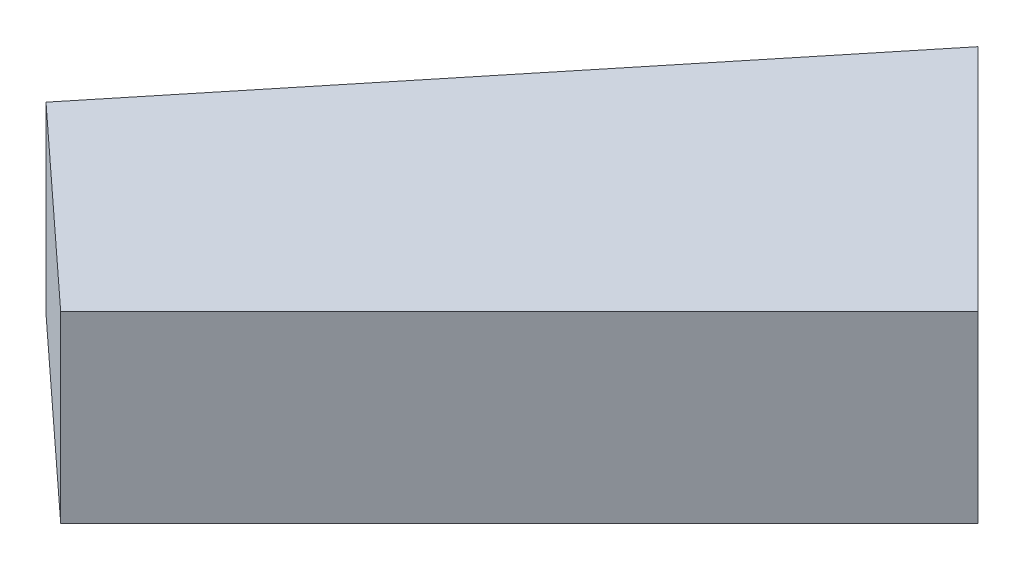
from build123d import *

# Parameters (mm, degrees)
EXTRUDE_START   = -9
EXTRUDE_1_DEPTH = 5


with BuildPart() as part:
    # 草图1 → 凸台-拉伸1 (new body)
    with BuildSketch(Plane(origin=(0, 0, 0), x_dir=(1, 0, 0), z_dir=(0, 1, 0)).offset(EXTRUDE_START)):
        Polygon((104.57, -48.37), (117.07, -35.87), (110.82, -29.62), (99.43, -43.63), align=None)
    extrude(amount=EXTRUDE_1_DEPTH)


solid = part.part
